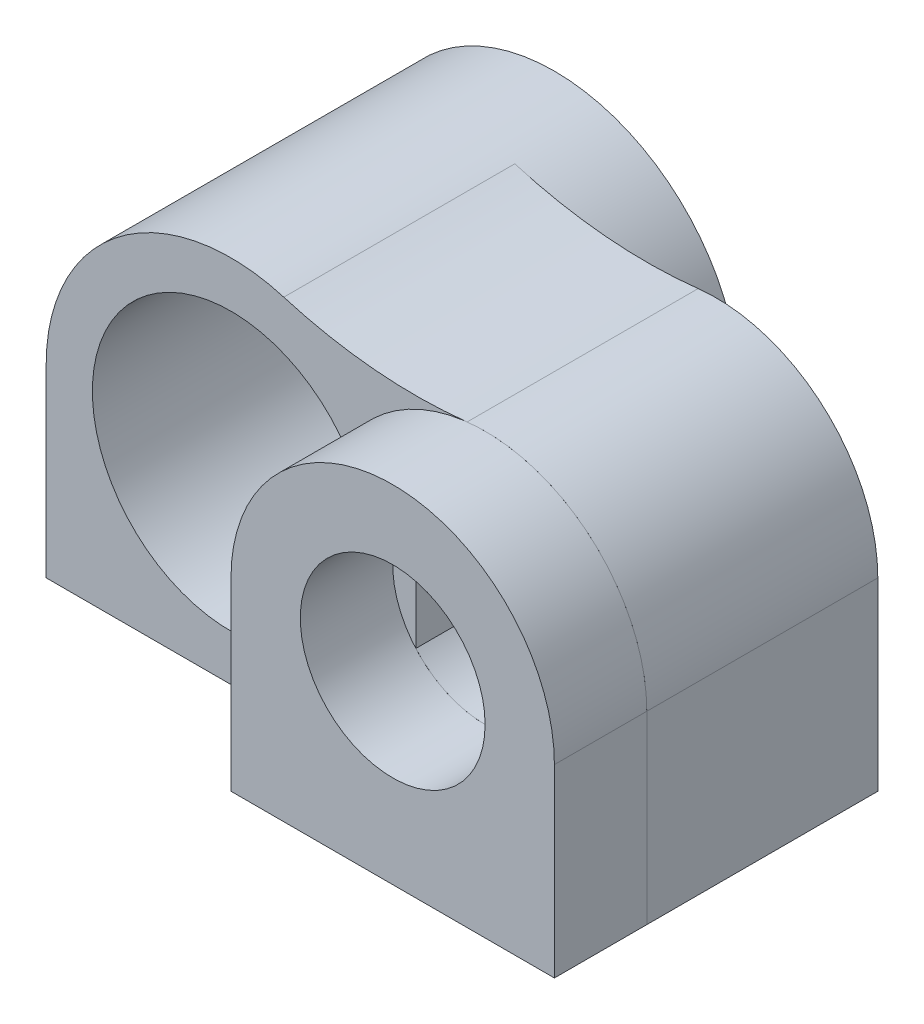
from build123d import *

# Parameters (mm, degrees)
SKETCH2_R           = 3
BOSS_EXTRUDE1_DEPTH = 7
BOSS_EXTRUDE2_START = -5
BOSS_EXTRUDE2_DEPTH = 5
SKETCH3_3_R         = 2
BOSS_EXTRUDE4_DEPTH = 2
FILLET1_R           = 10


with BuildPart() as part:
    # Sketch2 → Boss-Extrude1 (new body)
    with BuildSketch(Plane.XY):
        with BuildLine():
            Line((-4, 0), (-4, -4))
            Line((-4, -4), (4, -4))
            Line((4, -4), (4, 0))
            ThreePointArc((4, 0), (0, 4), (-4, 0))
        make_face()
        Circle(SKETCH2_R, mode=Mode.SUBTRACT)
    extrude(amount=BOSS_EXTRUDE1_DEPTH)

    # Sketch3 → Boss-Extrude2 (add)
    with BuildSketch(Plane.XY.offset(7).offset(BOSS_EXTRUDE2_START)):
        with BuildLine():
            ThreePointArc((9, 0), (6.881698559, 3.215728392), (3.090909091, 2.538952735))
            ThreePointArc((3.090909091, 2.538952735), (3.538092662, 1.86598508), (3.840909091, 1.116878398))
            ThreePointArc((3.840909091, 1.116878398), (6.083874208, 1.912875038), (7.5, 0))
            ThreePointArc((7.5, 0), (6.207106781, -1.870828693), (4, -1.322875656))
            Line((4, -1.322875656), (4, -4))
            Line((4, -4), (9, -4))
            Line((9, -4), (9, 0))
        make_face()
    extrude(amount=BOSS_EXTRUDE2_DEPTH)

    # Fillet1
    fillet1_edges = [part.edges().sort_by_distance(p)[0] for p in [
        (3.090909091, 2.538952735, 4.5),
    ]]
    fillet(fillet1_edges, radius=FILLET1_R)


with BuildPart() as body_2:
    # Sketch3<3> → Boss-Extrude4 (new body)
    with BuildSketch(Plane.XY.offset(7)):
        with BuildLine():
            Line((2, 0), (2, -4))
            Line((2, -4), (9, -4))
            Line((9, -4), (9, 0))
            ThreePointArc((9, 0), (5.5, 3.5), (2, 0))
        make_face()
        with Locations((5.5, 0)):
            Circle(SKETCH3_3_R, mode=Mode.SUBTRACT)
    extrude(amount=BOSS_EXTRUDE4_DEPTH)


solid = Compound([part.part, body_2.part])
